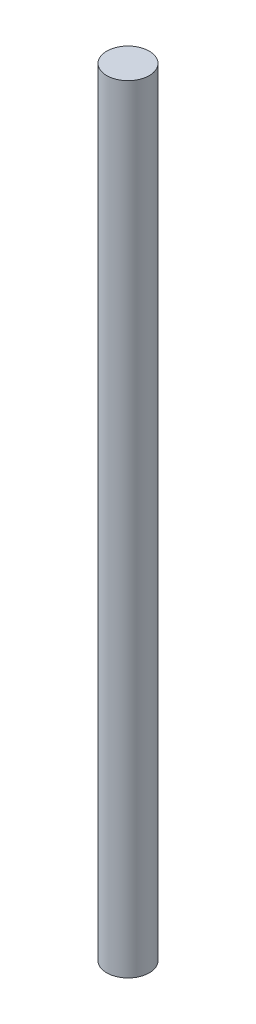
from build123d import *

# Parameters (mm, degrees)
SKETCH_1_R      = 4
EXTRUDE_1_DEPTH = 125
EXTRUDE_START   = 21.39
SKETCH_2_R      = 4
EXTRUDE_2_DEPTH = 21.39


with BuildPart() as part:
    # 草图1 → 凸台-拉伸1 (new body)
    with BuildSketch(Plane(origin=(0, 0, 0), x_dir=(1, 0, 0), z_dir=(0, 1, 0))):
        with Locations(Location((0, 0, 0), (0, 0, 270))):
            Circle(SKETCH_1_R)
    extrude(amount=EXTRUDE_1_DEPTH)

    # 草图2 → 凸台-拉伸2 (add)
    with BuildSketch(Plane.XZ.offset(EXTRUDE_START)):
        Circle(SKETCH_2_R)
    extrude(amount=-EXTRUDE_2_DEPTH)


solid = part.part
